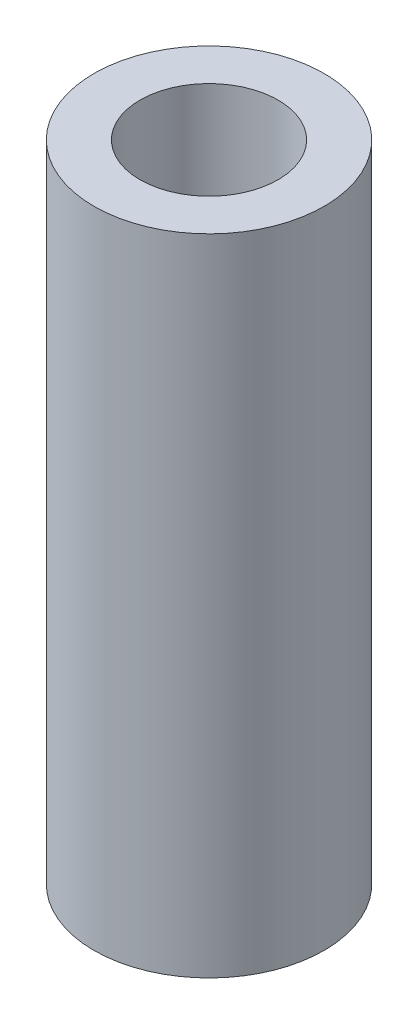
from build123d import *

# Parameters (mm, degrees)
SKETCH1_R           = 5
SKETCH1_R_2         = 1.5875
BOSS_EXTRUDE1_DEPTH = 14
SKETCH2_R           = 3
CUT_EXTRUDE1_DEPTH  = 12


with BuildPart() as part:
    # Sketch1 → Boss-Extrude1 (new, symmetric)
    with BuildSketch(Plane(origin=(0, 0, 0), x_dir=(1, 0, 0), z_dir=(0, 1, 0))):
        with Locations(Location((0, 0, 0), (0, 0, 270))):
            Circle(SKETCH1_R)
        with Locations(Location((0, 0, 0), (0, 0, 270))):
            Circle(SKETCH1_R_2, mode=Mode.SUBTRACT)
    extrude(amount=BOSS_EXTRUDE1_DEPTH, both=True)

    # Sketch2 → Cut-Extrude1 (cut)
    with BuildSketch(Plane(origin=(0, 14, 0), x_dir=(1, 0, 0), z_dir=(0, 1, 0))):
        with Locations(Location((0, 0, 0), (0, 0, 270))):
            Circle(SKETCH2_R)
    extrude(amount=-CUT_EXTRUDE1_DEPTH, mode=Mode.SUBTRACT)


solid = part.part
